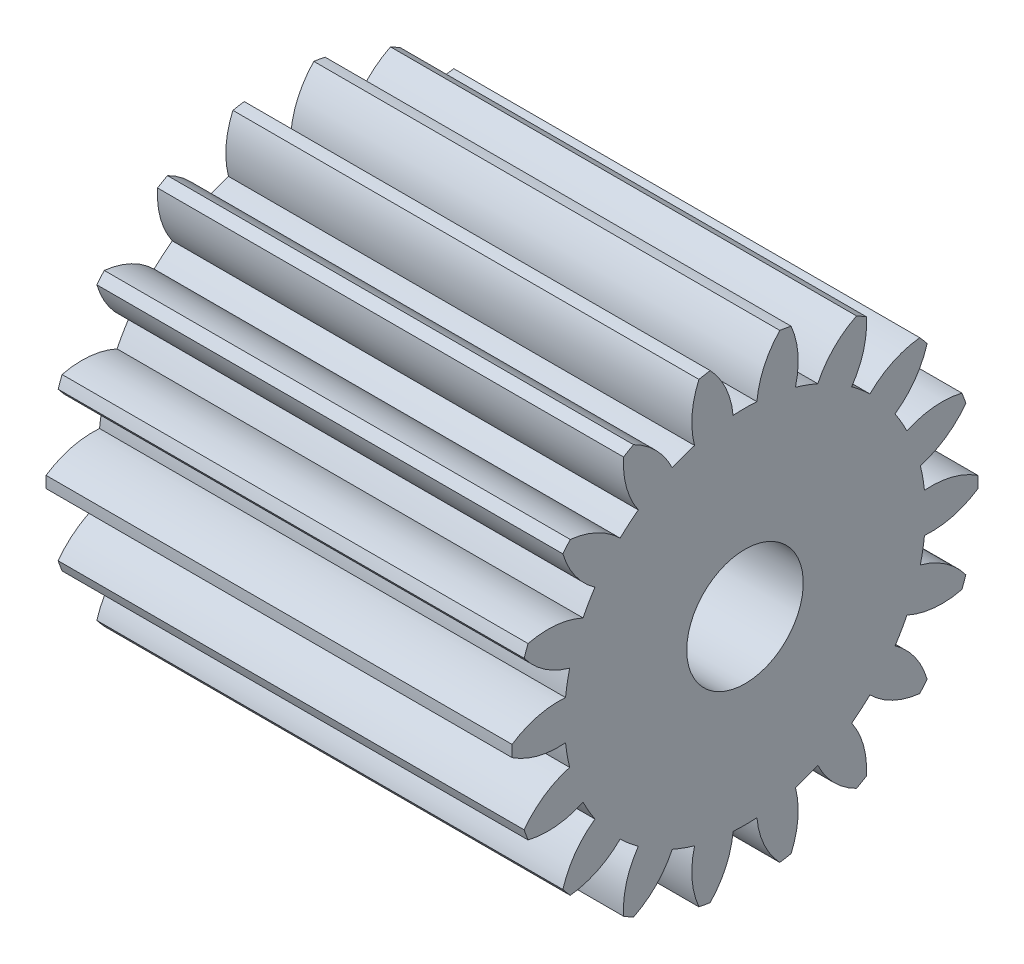
from build123d import *

# Parameters (mm, degrees)
BASPROSKE_W     = 10
BASPROSKE_H     = 5
TOOTHCUT_DEPTH  = 13.247448714
TEETHCUTS_COUNT = 18
TEETHCUTS_ANGLE = 340
BORSKE_R        = 1.25
BORE_DEPTH      = 50.0000508


with BuildPart() as part:
    # BasProSke → Base-Revolve (revolve)
    with BuildSketch(Plane(origin=(0, 0, 0), x_dir=(1, 0, 0), z_dir=(0, 1, 0)), mode=Mode.PRIVATE) as base_revolve_sk:
        with Locations((5, 2.5)):
            Rectangle(BASPROSKE_W, BASPROSKE_H)
    revolve(base_revolve_sk.sketch.rotate(Axis((-10, 0, 0), (1, 0, 0)), 180), axis=Axis((-10, 0, 0), (1, 0, 0)))

    # TooCutSke → ToothCut (cut, through all)
    with BuildSketch(Plane(origin=(0, 0, 0), x_dir=(0, 0, -1), z_dir=(1, 0, 0))):
        with BuildLine():
            ThreePointArc((0.25527463, 3.865580275), (0, 3.874), (-0.25527463, 3.865580275))
            ThreePointArc((-0.25527463, 3.865580275), (-0.416281865, 4.46052923), (-0.768562654, 4.96628197))
            ThreePointArc((-0.768562654, 4.96628197), (0, 5.0254), (0.768562654, 4.96628197))
            ThreePointArc((0.768562654, 4.96628197), (0.416281865, 4.46052923), (0.25527463, 3.865580275))
        make_face()
    toothcut = extrude(amount=TOOTHCUT_DEPTH, mode=Mode.SUBTRACT)

    # TeethCuts: ToothCut ×18 about axis
    teethcuts_axis = Axis((-10, 0, 0), (1, 0, 0))
    for i in range(1, TEETHCUTS_COUNT):
        add(toothcut.rotate(teethcuts_axis, i * TEETHCUTS_ANGLE / (TEETHCUTS_COUNT - 1)), mode=Mode.SUBTRACT)

    # BorSke → Bore (cut, symmetric)
    with BuildSketch(Plane(origin=(0, 0, 0), x_dir=(0, 0, -1), z_dir=(1, 0, 0))):
        with Locations(Location((0, 0, 0), (0, 0, 180))):
            Circle(BORSKE_R)
    extrude(amount=BORE_DEPTH, both=True, mode=Mode.SUBTRACT)


solid = part.part
